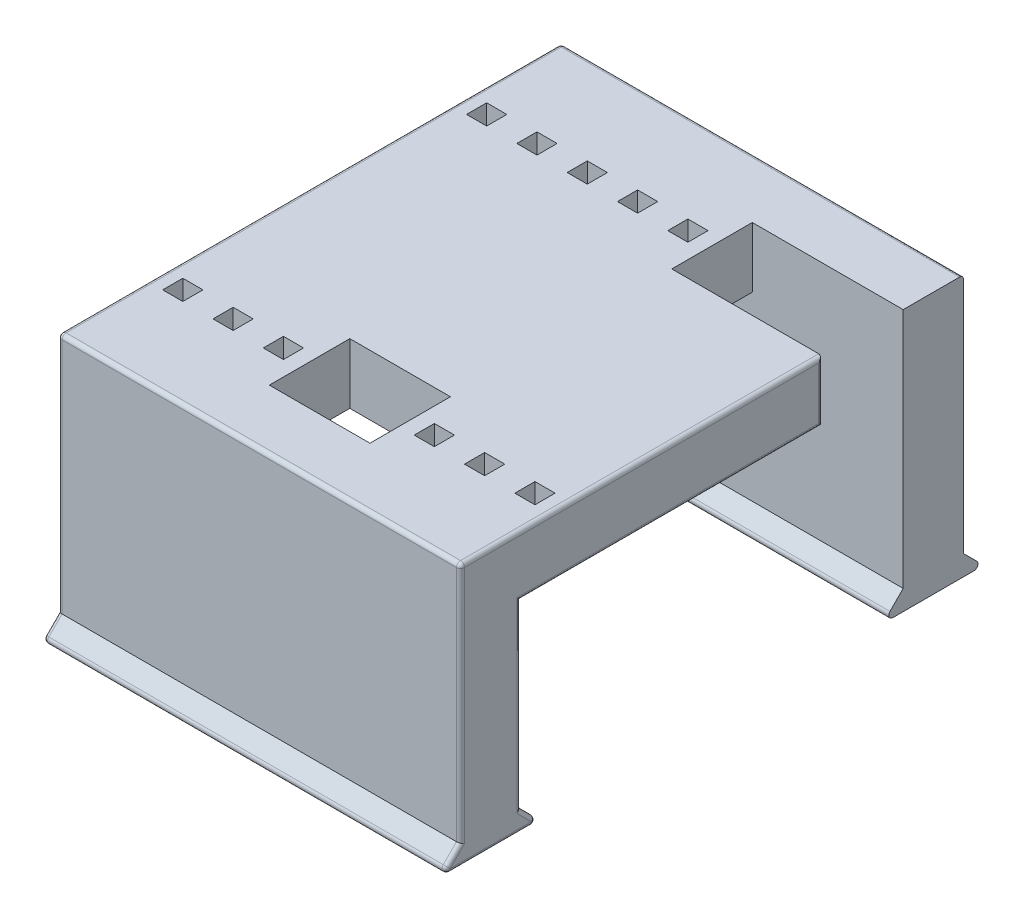
from build123d import *

# Parameters (mm, degrees)
SKETCH_2_W          = 20
SKETCH_2_H          = 25
SKETCH_2_W_2        = 1
SKETCH_2_H_2        = 1
EXTRUDE_1_DEPTH     = 3
SKETCH_3_W          = 20
SKETCH_3_H          = 3
EXTRUDE_2_DEPTH     = 10
SKETCH_5_W          = 7.5
SKETCH_5_H          = 4
SKETCH_5_W_2        = 5
CUT_EXTRUDE_1_DEPTH = 3
EXTRUDE_3_DEPTH     = 20
FILLET_1_R          = 0.2


with BuildPart() as part:
    # 草图2 → 凸台-拉伸1 (new body)
    with BuildSketch(Plane(origin=(0, 0, 0), x_dir=(1, 0, 0), z_dir=(0, 1, 0))):
        with Locations((10, 0)):
            Rectangle(SKETCH_2_W, SKETCH_2_H)
        with Locations((1.25, -7.55)):
            Rectangle(SKETCH_2_W_2, SKETCH_2_H_2, mode=Mode.SUBTRACT)
        with Locations((3.75, -7.55)):
            Rectangle(SKETCH_2_W_2, SKETCH_2_H_2, mode=Mode.SUBTRACT)
        with Locations((6.25, -7.55)):
            Rectangle(SKETCH_2_W_2, SKETCH_2_H_2, mode=Mode.SUBTRACT)
        with Locations((8.75, -7.55)):
            Rectangle(SKETCH_2_W_2, SKETCH_2_H_2, mode=Mode.SUBTRACT)
        with Locations((11.25, -7.55)):
            Rectangle(SKETCH_2_W_2, SKETCH_2_H_2, mode=Mode.SUBTRACT)
        with Locations((13.75, -7.55)):
            Rectangle(SKETCH_2_W_2, SKETCH_2_H_2, mode=Mode.SUBTRACT)
        with Locations((16.25, -7.55)):
            Rectangle(SKETCH_2_W_2, SKETCH_2_H_2, mode=Mode.SUBTRACT)
        with Locations((18.75, -7.55)):
            Rectangle(SKETCH_2_W_2, SKETCH_2_H_2, mode=Mode.SUBTRACT)
        with Locations((18.75, 7.55)):
            Rectangle(SKETCH_2_W_2, SKETCH_2_H_2, mode=Mode.SUBTRACT)
        with Locations((16.25, 7.55)):
            Rectangle(SKETCH_2_W_2, SKETCH_2_H_2, mode=Mode.SUBTRACT)
        with Locations((13.75, 7.55)):
            Rectangle(SKETCH_2_W_2, SKETCH_2_H_2, mode=Mode.SUBTRACT)
        with Locations((11.25, 7.55)):
            Rectangle(SKETCH_2_W_2, SKETCH_2_H_2, mode=Mode.SUBTRACT)
        with Locations((8.75, 7.55)):
            Rectangle(SKETCH_2_W_2, SKETCH_2_H_2, mode=Mode.SUBTRACT)
        with Locations((6.25, 7.55)):
            Rectangle(SKETCH_2_W_2, SKETCH_2_H_2, mode=Mode.SUBTRACT)
        with Locations((3.75, 7.55)):
            Rectangle(SKETCH_2_W_2, SKETCH_2_H_2, mode=Mode.SUBTRACT)
        with Locations((1.25, 7.55)):
            Rectangle(SKETCH_2_W_2, SKETCH_2_H_2, mode=Mode.SUBTRACT)
    extrude(amount=EXTRUDE_1_DEPTH)

    # 草图3 → 凸台-拉伸2 (add)
    with BuildSketch(Plane.XZ):
        with Locations((10, 11)):
            Rectangle(SKETCH_3_W, SKETCH_3_H)
        with Locations((10, -11)):
            Rectangle(SKETCH_3_W, SKETCH_3_H)
    extrude(amount=EXTRUDE_2_DEPTH)

    # 草图5 → 切除-拉伸1 (cut)
    with BuildSketch(Plane(origin=(0, 3, 0), x_dir=(1, 0, 0), z_dir=(0, 1, 0))):
        with Locations((16.25, 7.5)):
            Rectangle(SKETCH_5_W, SKETCH_5_H)
        with Locations((10, -7.5)):
            Rectangle(SKETCH_5_W_2, SKETCH_5_H)
    extrude(amount=-CUT_EXTRUDE_1_DEPTH, mode=Mode.SUBTRACT)

    # 草图4 → 凸台-拉伸3 (add)
    with BuildSketch(Plane(origin=(20, 0, 0), x_dir=(0, 0, -1), z_dir=(1, 0, 0))):
        Polygon((-12.5, -10), (-13.5, -10), (-12.5, -9), align=None)
        Polygon((9.5, -10), (8.5, -10), (9.5, -9), align=None)
        Polygon((12.5, -10), (13.5, -10), (12.5, -9), align=None)
        Polygon((-9.5, -10), (-8.5, -10), (-9.5, -9), align=None)
    extrude(amount=-EXTRUDE_3_DEPTH)

    # 圆角1
    fillet_1_edges = [part.edges().sort_by_distance(p)[0] for p in [
        (20, 3, 3.5),
        (10, 3, -12.5),
        (20, 0, 2),
        (0, -10, 11),
        (20, -10, 11),
        (0, 0, 0),
        (0, -10, -11),
        (20, 1.5, -5.5),
        (10, -10, 13.5),
        (20, -9.5, 13),
        (0, -9.5, 13),
        (0, -4.5, -9.5),
        (10, -10, -8.5),
        (0, -9.5, -9),
        (10, -10, -13.5),
        (0, -9.5, -13),
        (20, -4.5, 9.5),
        (0, -4.5, 9.5),
        (10, -10, 8.5),
        (20, -9.5, 9),
        (0, -9.5, 9),
        (0, 3, 0),
        (0, -3, -12.5),
        (20, -3, 12.5),
        (0, -3, 12.5),
        (10, 3, 12.5),
    ]]
    fillet(fillet_1_edges, radius=FILLET_1_R)


solid = part.part
